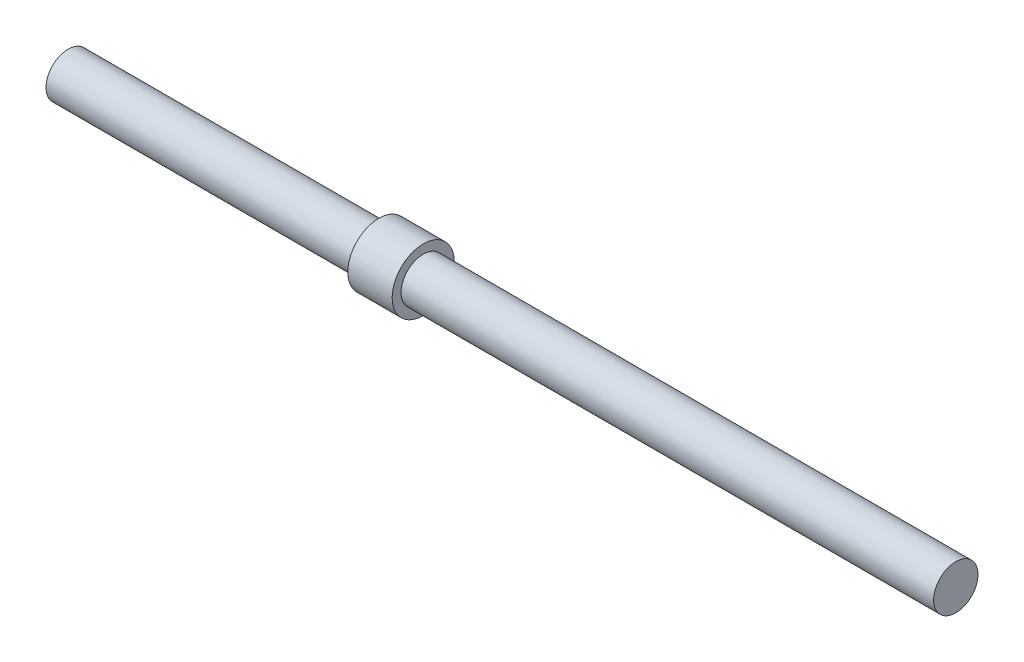
from build123d import *

# Parameters (mm, degrees)
SKETCH1_R           = 5
BOSS_EXTRUDE1_DEPTH = 100
BOSS_EXTRUDE2_START = -70
SKETCH2_R           = 7
BOSS_EXTRUDE2_DEPTH = 10


with BuildPart() as part:
    # Sketch1 → Boss-Extrude1 (new, symmetric)
    with BuildSketch(Plane(origin=(0, 0, 0), x_dir=(0, 0, -1), z_dir=(1, 0, 0))):
        Circle(SKETCH1_R)
    extrude(amount=BOSS_EXTRUDE1_DEPTH, both=True)

    # Sketch2 → Boss-Extrude2 (add)
    with BuildSketch(Plane.ZY.offset(100).offset(BOSS_EXTRUDE2_START)):
        Circle(SKETCH2_R)
    extrude(amount=-BOSS_EXTRUDE2_DEPTH)


solid = part.part
